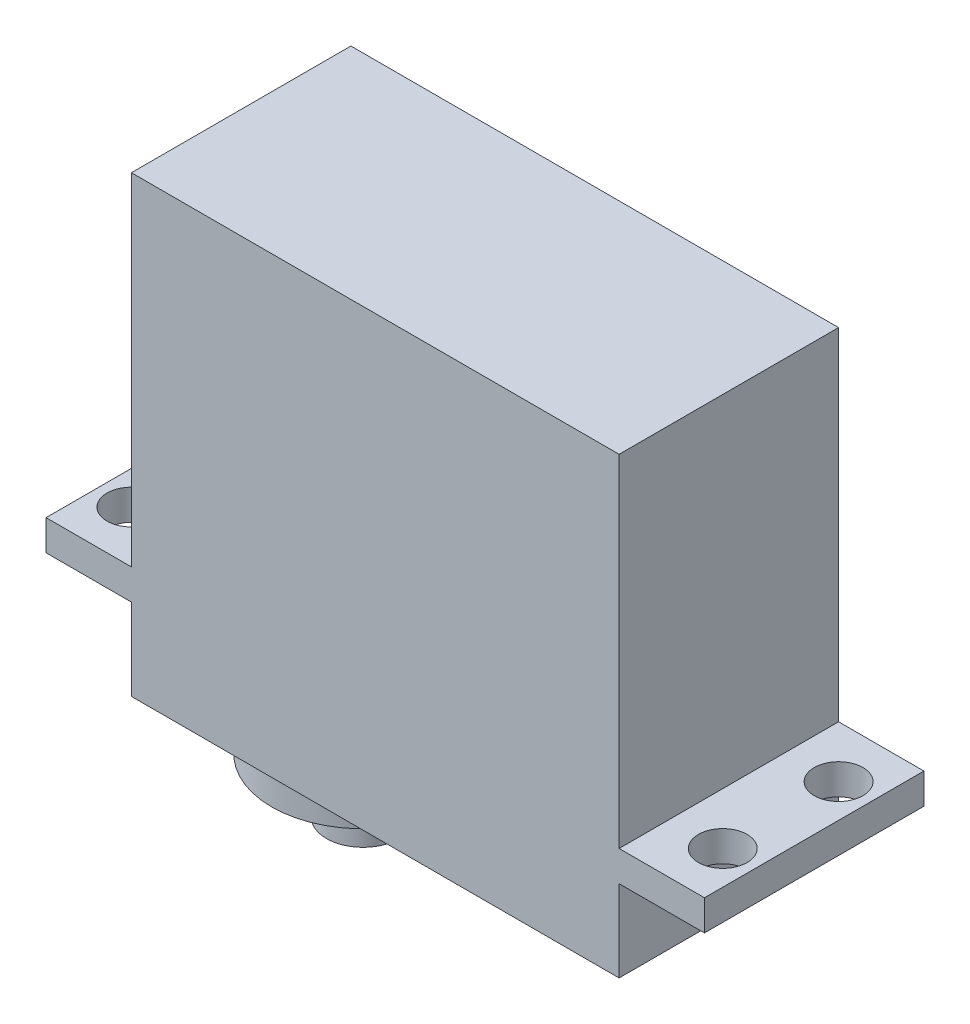
from build123d import *

# Parameters (mm, degrees)
SKETCH_1_W          = 54
SKETCH_1_H          = 18
EXTRUDE_1_DEPTH     = 2.5
SKETCH_2_W          = 40
SKETCH_2_H          = 18
EXTRUDE_2_DEPTH     = 28
SKETCH_3_W          = 40
SKETCH_3_H          = 18
EXTRUDE_3_DEPTH     = 6.7
SKETCH_4_R          = 7.5
EXTRUDE_4_DEPTH     = 3.6
SKETCH_5_R          = 3
EXTRUDE_5_DEPTH     = 4.5
SKETCH_6_R          = 2
CUT_EXTRUDE_1_DEPTH = 4.5


with BuildPart() as part:
    # 草图1 → 凸台-拉伸1 (new body)
    with BuildSketch(Plane(origin=(0, 0, 0), x_dir=(1, 0, 0), z_dir=(0, 1, 0))):
        Rectangle(SKETCH_1_W, SKETCH_1_H)
    extrude(amount=EXTRUDE_1_DEPTH)

    # 草图2 → 凸台-拉伸2 (add)
    with BuildSketch(Plane(origin=(0, 2.5, 0), x_dir=(1, 0, 0), z_dir=(0, 1, 0))):
        Rectangle(SKETCH_2_W, SKETCH_2_H)
    extrude(amount=EXTRUDE_2_DEPTH)

    # 草图3 → 凸台-拉伸3 (add)
    with BuildSketch(Plane.XZ):
        Rectangle(SKETCH_3_W, SKETCH_3_H)
    extrude(amount=EXTRUDE_3_DEPTH)

    # 草图4 → 凸台-拉伸4 (add)
    with BuildSketch(Plane.XZ.offset(6.7)):
        with Locations(Location((-10, 0, 0), (0, 0, 90))):
            Circle(SKETCH_4_R)
    extrude(amount=EXTRUDE_4_DEPTH)

    # 草图5 → 凸台-拉伸5 (add)
    with BuildSketch(Plane.XZ.offset(10.3)):
        with Locations(Location((-10, 0, 0), (0, 0, 270))):
            Circle(SKETCH_5_R)
    extrude(amount=EXTRUDE_5_DEPTH)

    # 草图6 → 切除-拉伸1 (cut)
    with BuildSketch(Plane.XZ):
        with Locations(Location((-24.25, 4.75, 0), (0, 0, 270))):
            Circle(SKETCH_6_R)
        with Locations(Location((-24.25, -4.75, 0), (0, 0, 270))):
            Circle(SKETCH_6_R)
        with Locations(Location((24.25, 4.75, 0), (0, 0, 270))):
            Circle(SKETCH_6_R)
        with Locations(Location((24.25, -4.75, 0), (0, 0, 270))):
            Circle(SKETCH_6_R)
    extrude(amount=-CUT_EXTRUDE_1_DEPTH, mode=Mode.SUBTRACT)


solid = part.part
